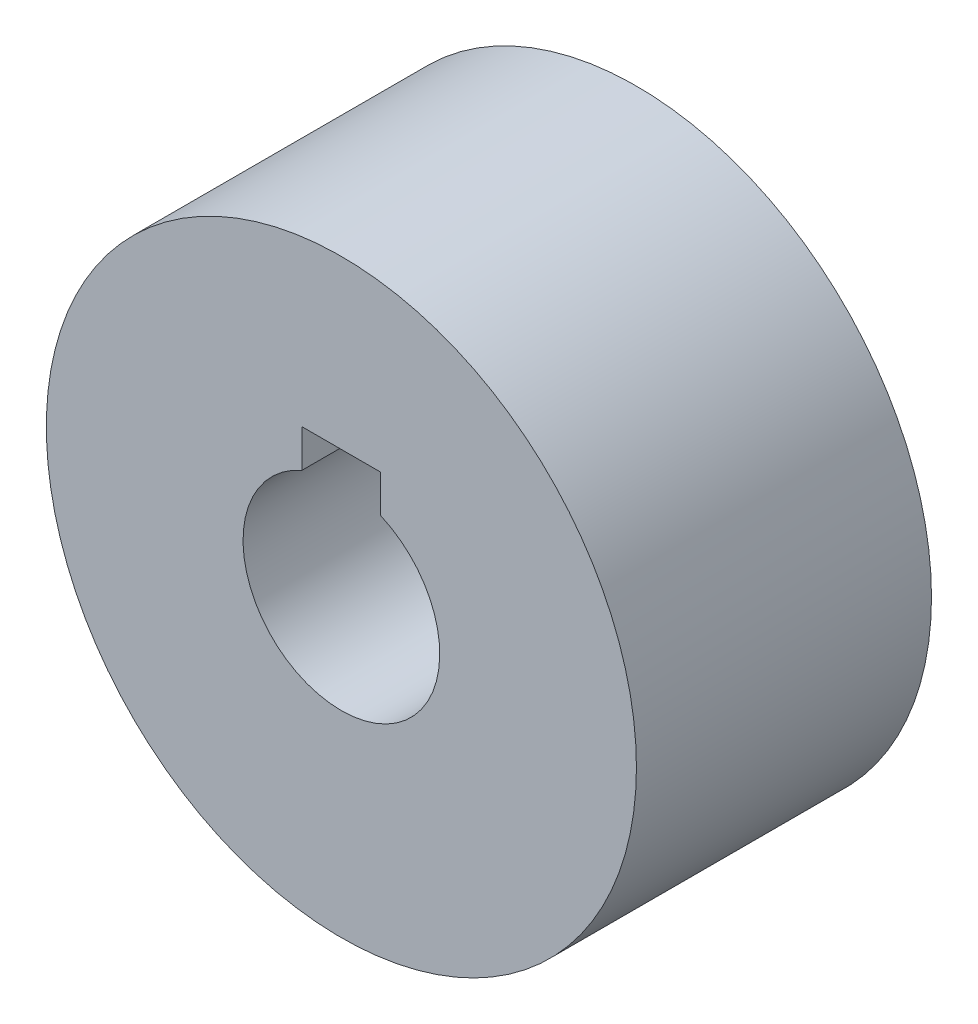
from build123d import *

# Parameters (mm, degrees)
SKETCH1_R           = 30
BOSS_EXTRUDE1_DEPTH = 30


with BuildPart() as part:
    # Sketch1 → Boss-Extrude1 (new body)
    with BuildSketch(Plane.XY):
        Circle(SKETCH1_R)
        with BuildLine():
            Line((4, 9.16515139), (4, 13))
            Line((4, 13), (-4, 13))
            Line((-4, 13), (-4, 9.16515139))
            ThreePointArc((-4, 9.16515139), (0, -10), (4, 9.16515139))
        make_face(mode=Mode.SUBTRACT)
    extrude(amount=BOSS_EXTRUDE1_DEPTH)


solid = part.part
